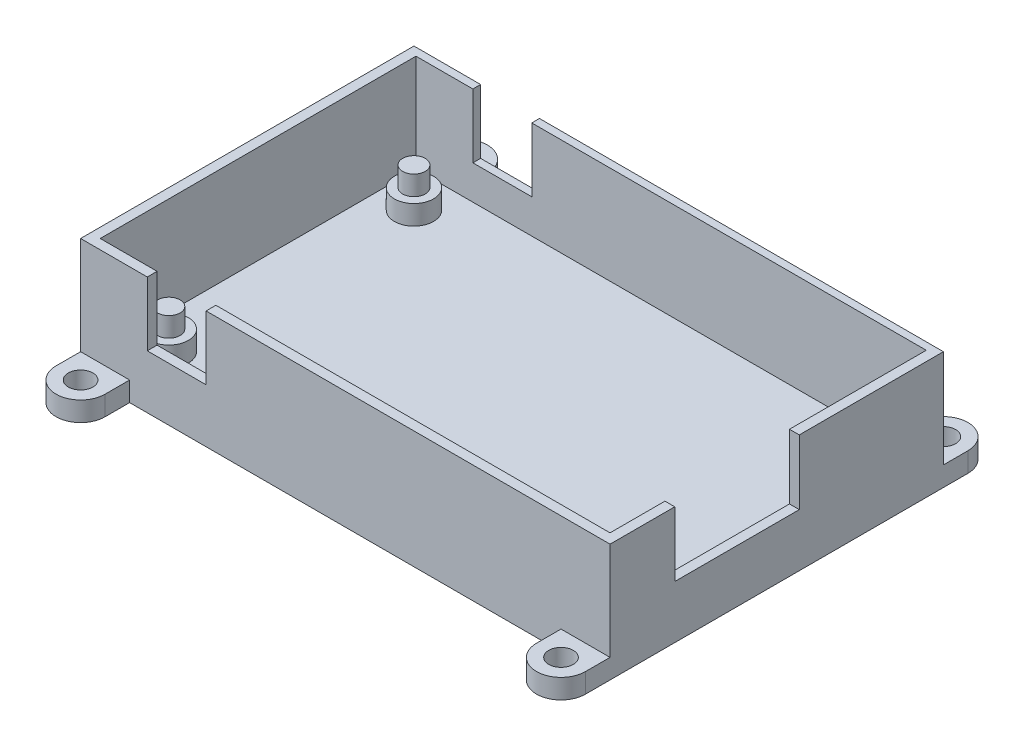
from build123d import *

# Parameters (mm, degrees)
SKETCH1_W                    = 68.58
SKETCH1_H                    = 43.18
BOSS_EXTRUDE1_DEPTH          = 2.54
SKETCH5_R                    = 2.54
BOSS_EXTRUDE2_DEPTH          = 2.54
SKETCH6_W                    = 68.58
SKETCH6_H                    = 43.18
BOSS_EXTRUDE3_DEPTH          = 12.7
SKETCH7_R                    = 1.4605
BOSS_EXTRUDE4_DEPTH          = 2.54
SKETCH8_W                    = 7.62
SKETCH8_H                    = 8.2856324
CUT_EXTRUDE1_DEPTH           = 83.46203005
SKETCH9_W                    = 16.129
SKETCH9_H                    = 8.382
CUT_EXTRUDE2_DEPTH           = 2.032
BOSS_EXTRUDE5_DEPTH          = 2.54
F_1_8_0_125_DIAMETER_HOLE1_D = 3.175


with BuildPart() as part:
    # Sketch1 → Boss-Extrude1 (new body)
    with BuildSketch(Plane(origin=(0, 0, 0), x_dir=(1, 0, 0), z_dir=(0, 1, 0))):
        with Locations((34.29, 21.59)):
            Rectangle(SKETCH1_W, SKETCH1_H)
    extrude(amount=BOSS_EXTRUDE1_DEPTH)

    # Sketch5 → Boss-Extrude2 (add)
    with BuildSketch(Plane(origin=(0, 2.54, 0), x_dir=(1, 0, 0), z_dir=(0, 1, 0))):
        with Locations(Location((5.715, 37.465, 0), (0, 0, 90))):
            Circle(SKETCH5_R)
        with Locations(Location((62.865, 37.465, 0), (0, 0, 90))):
            Circle(SKETCH5_R)
        with Locations(Location((5.715, 5.715, 0), (0, 0, 90))):
            Circle(SKETCH5_R)
        with Locations(Location((62.865, 5.715, 0), (0, 0, 90))):
            Circle(SKETCH5_R)
    extrude(amount=BOSS_EXTRUDE2_DEPTH)

    # Sketch6 → Boss-Extrude3 (add)
    with BuildSketch(Plane(origin=(0, 2.54, 0), x_dir=(1, 0, 0), z_dir=(0, 1, 0))):
        with Locations((34.29, 21.59)):
            Rectangle(SKETCH6_W, SKETCH6_H)
        Polygon((1.27, 42.171922196), (1.27, 1.27), (67.31, 1.27), (67.31, 42.229552983), align=None, mode=Mode.SUBTRACT)
    extrude(amount=BOSS_EXTRUDE3_DEPTH)

    # Sketch7 → Boss-Extrude4 (add)
    with BuildSketch(Plane(origin=(0, 5.08, 0), x_dir=(1, 0, 0), z_dir=(0, 1, 0))):
        with Locations(Location((5.715, 37.465, 0), (0, 0, 270))):
            Circle(SKETCH7_R)
        with Locations(Location((5.715, 5.715, 0), (0, 0, 270))):
            Circle(SKETCH7_R)
        with Locations(Location((62.865, 5.715, 0), (0, 0, 270))):
            Circle(SKETCH7_R)
        with Locations(Location((62.865, 37.465, 0), (0, 0, 270))):
            Circle(SKETCH7_R)
    extrude(amount=BOSS_EXTRUDE4_DEPTH)

    # Sketch8 → Cut-Extrude1 (cut, through all)
    with BuildSketch(Plane.XY):
        with Locations((12.446, 11.0971838)):
            Rectangle(SKETCH8_W, SKETCH8_H)
    extrude(amount=-CUT_EXTRUDE1_DEPTH, mode=Mode.SUBTRACT)

    # Sketch9 → Cut-Extrude2 (cut)
    with BuildSketch(Plane(origin=(68.58, 0, 0), x_dir=(0, 0, -1), z_dir=(1, 0, 0))):
        with Locations((16.4465, 11.049)):
            Rectangle(SKETCH9_W, SKETCH9_H)
    extrude(amount=-CUT_EXTRUDE2_DEPTH, mode=Mode.SUBTRACT)

    # Sketch10 → Boss-Extrude5 (add)
    with BuildSketch(Plane.XZ):
        with BuildLine():
            Line((0, 3.175), (0, 0))
            Line((0, 0), (6.35, 0))
            Line((6.35, 0), (6.35, 3.175))
            ThreePointArc((6.35, 3.175), (3.175, 6.35), (0, 3.175))
        make_face()
        with BuildLine():
            Line((6.35, -46.355), (6.35, -43.18))
            Line((6.35, -43.18), (0, -43.18))
            Line((0, -43.18), (0, -46.355))
            ThreePointArc((0, -46.355), (3.175, -49.53), (6.35, -46.355))
        make_face()
        with BuildLine():
            Line((68.58, -46.355), (68.58, -43.18))
            Line((68.58, -43.18), (62.23, -43.18))
            Line((62.23, -43.18), (62.23, -46.355))
            ThreePointArc((62.23, -46.355), (65.405, -49.53), (68.58, -46.355))
        make_face()
        with BuildLine():
            Line((62.23, 3.175), (62.23, 0))
            Line((62.23, 0), (68.58, 0))
            Line((68.58, 0), (68.58, 3.175))
            ThreePointArc((68.58, 3.175), (65.405, 6.35), (62.23, 3.175))
        make_face()
    extrude(amount=-BOSS_EXTRUDE5_DEPTH)

    # 1/8 (0.125) Diameter Hole1 (through all)
    with Locations(Plane(origin=(0, 2.54, 0), x_dir=(1, 0, 0), z_dir=(0, 1, 0))):
        with Locations((65.405, 46.355), (3.175, 46.355), (3.175, -3.175), (65.405, -3.175)):
            Hole(F_1_8_0_125_DIAMETER_HOLE1_D / 2)


solid = part.part
